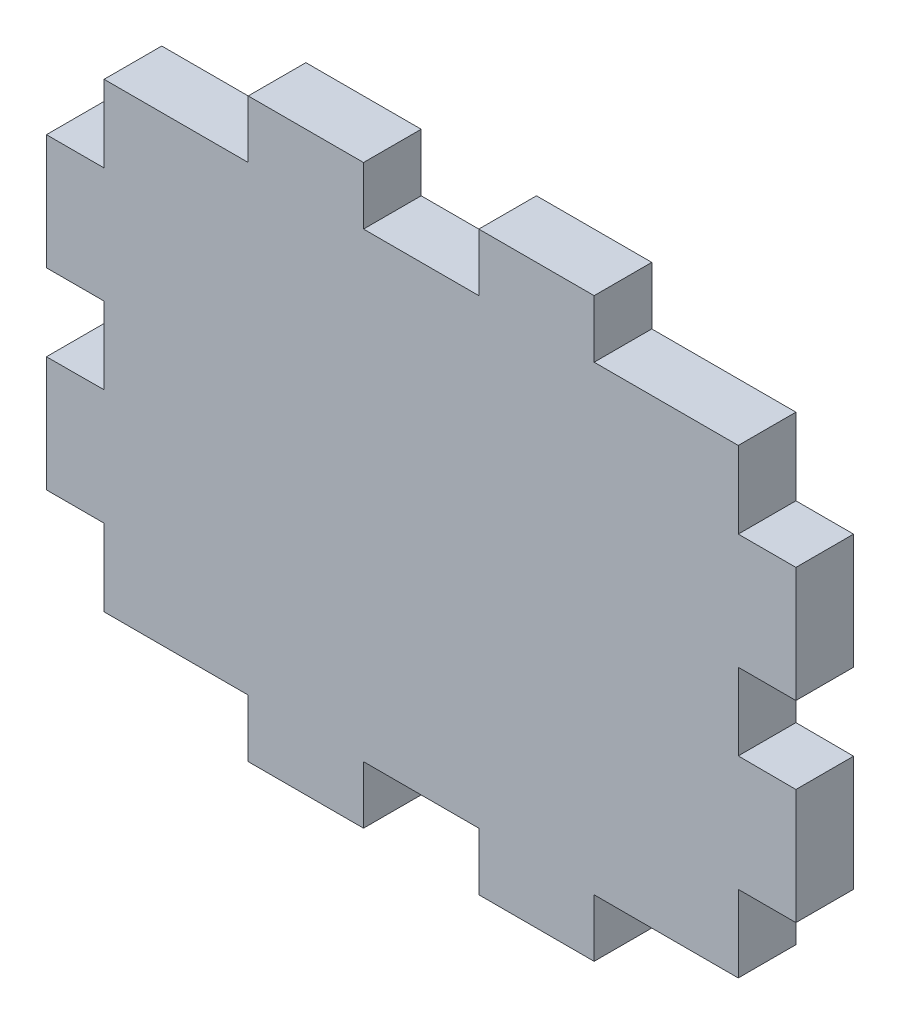
from build123d import *

# Parameters (mm, degrees)
BOSS_EXTRUDE1_DEPTH = 2.5


with BuildPart() as part:
    # Sketch1 → Boss-Extrude1 (new body)
    with BuildSketch(Plane.XY):
        Polygon((-2.5, -12.5), (-2.5, -10), (2.5, -10), (2.5, -12.5), (7.5, -12.5), (7.5, -10), (13.75, -10), (13.75, -6.67), (16.25, -6.67), (16.25, -1.67), (13.75, -1.66), (13.75, 1.67), (16.25, 1.67), (16.25, 6.67), (13.75, 6.67), (13.75, 10), (7.5, 10), (7.5, 12.5), (2.5, 12.5), (2.5, 10), (-2.5, 10), (-2.5, 12.5), (-7.5, 12.5), (-7.5, 10), (-13.75, 10), (-13.75, 6.67), (-16.25, 6.67), (-16.25, 1.67), (-13.75, 1.67), (-13.75, -1.66), (-16.25, -1.67), (-16.25, -6.67), (-13.75, -6.67), (-13.75, -10), (-7.5, -10), (-7.5, -12.5), align=None)
    extrude(amount=BOSS_EXTRUDE1_DEPTH)


solid = part.part
